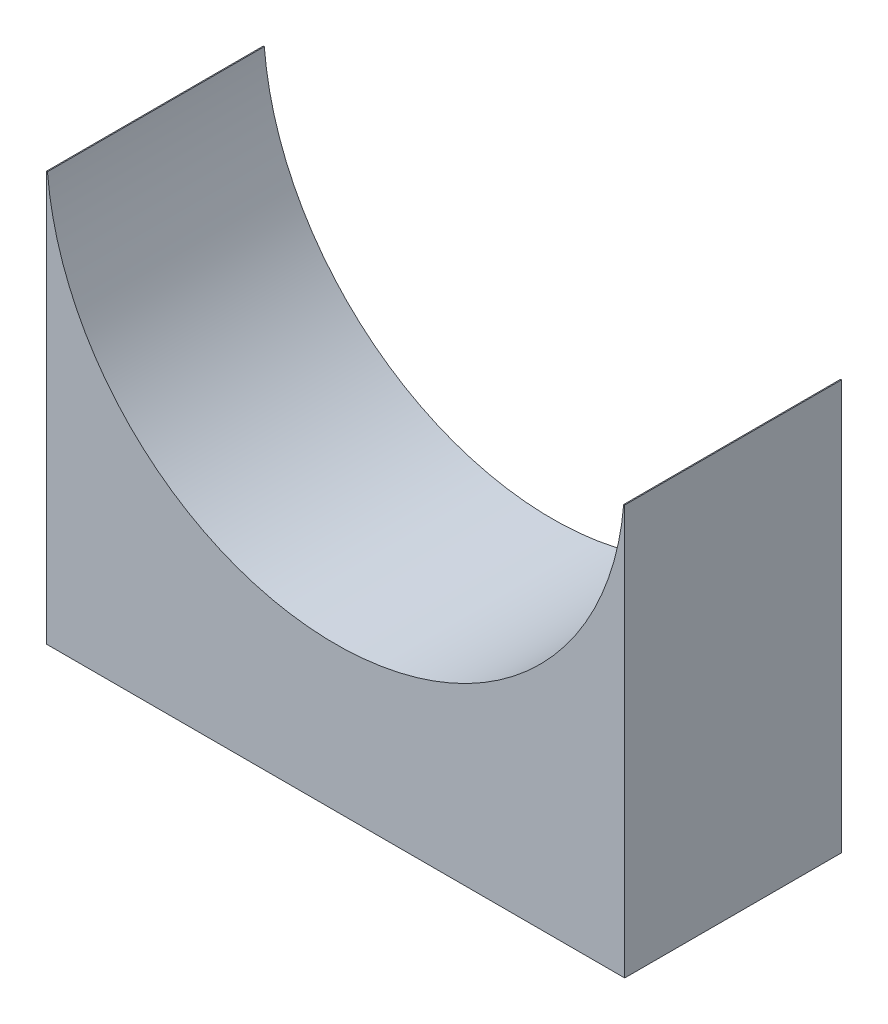
from build123d import *

# Parameters (mm, degrees)
BOSS_EXTRUDE3_DEPTH = 4.5


with BuildPart() as part:
    # Sketch9<3> → Boss-Extrude3 (new body)
    with BuildSketch(Plane.XY):
        with BuildLine():
            Line((-5.979130372, -0.5), (-6, -0.5))
            Line((-6, -0.5), (-6, -9))
            Line((-6, -9), (6, -9))
            Line((6, -9), (6, -0.5))
            Line((6, -0.5), (5.979130372, -0.5))
            ThreePointArc((5.979130372, -0.5), (0, -6), (-5.979130372, -0.5))
        make_face()
    extrude(amount=BOSS_EXTRUDE3_DEPTH)


solid = part.part
